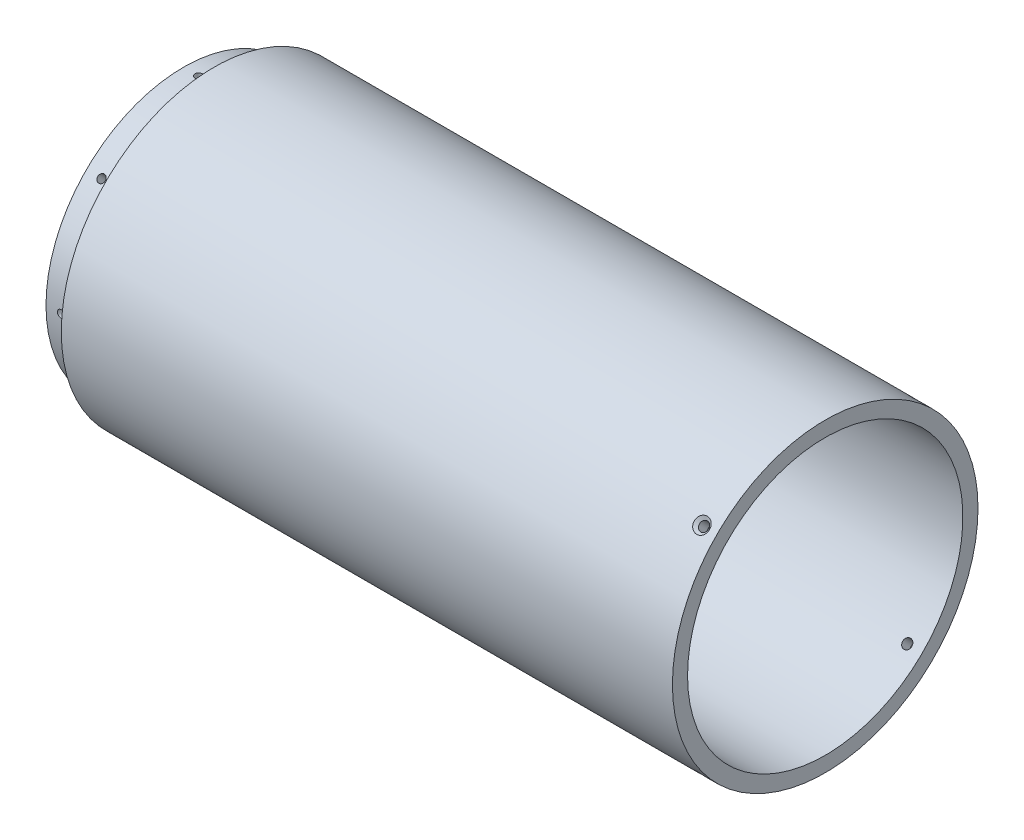
from build123d import *

# Parameters (mm, degrees)
CUT_EXTRUDE23_REACH      = 486.442
CUT_EXTRUDE23_END_RADIUS = 90.1
SKETCH23_R               = 3
CIRPATTERN30_COUNT       = 4
CUT_EXTRUDE25_REACH      = 486.442
CUT_EXTRUDE25_END_RADIUS = 80
SKETCH25_R               = 2.5
CIRPATTERN31_COUNT       = 8


with BuildPart() as part:
    # Sketch1 → Revolve1 (revolve)
    with BuildSketch(Plane.XY, mode=Mode.PRIVATE) as revolve1_sk:
        Polygon((0, 90.1), (-390, 90.1), (-390, 80), (-420, 80), (-420, 90), (-400, 90), (-400, 100), (0, 100), align=None)
    revolve(revolve1_sk.sketch.rotate(Axis((-171.770602606, 0, 0), (1, 0, 0)), 90), axis=Axis((-171.770602606, 0, 0), (1, 0, 0)))

    # Cut-Extrude23: up to this cylinder (the profile starts outside it)
    cut_extrude23_end = Plane(origin=(-10, 0, 0), z_dir=(-1, 0, 0)) * Cylinder(CUT_EXTRUDE23_END_RADIUS, 1154.084, mode=Mode.PRIVATE)
    # Sketch23 → Cut-Extrude23 (cut, up to the surface)
    with BuildSketch(Plane(origin=(0, -70.710678119, 70.710678119), x_dir=(1, 0, 0), z_dir=(0, -0.7071067811865478, 0.7071067811865474)), mode=Mode.PRIVATE) as cut_extrude23_sk1:
        with Locations(Location((-10, 0, 0), (0, 0, 270))):
            Circle(SKETCH23_R)
    cut_extrude23_tool1 = extrude(cut_extrude23_sk1.sketch, amount=-CUT_EXTRUDE23_REACH, mode=Mode.PRIVATE) - cut_extrude23_end
    cut_extrude23 = cut_extrude23_tool1.solids().sort_by_distance((-10, -70.710678, 70.710678))[0]
    add(cut_extrude23, mode=Mode.SUBTRACT)

    # Cut-Extrude24 cone 1 section (through the dimple's axis) → Cut-Extrude24 (revolve, cut)
    with BuildSketch(Plane(origin=(-10, -70.710678119, 70.710678119), x_dir=(0, -0.707106781, -0.707106781), z_dir=(1, 0, 0))):
        Polygon((0, 0), (5, 0), (0, 5), align=None)
    cut_extrude24 = revolve(axis=Axis((-10, -70.710678119, 70.710678119), (0, 0.707106781, -0.707106781)), mode=Mode.SUBTRACT)

    # CirPattern30: Cut-Extrude23, Cut-Extrude24 ×4 about axis
    cirpattern30_axis = Axis((-171.770602606, 0, 0), (1, 0, 0))
    add([cut_extrude23.rotate(cirpattern30_axis, i * 360 / CIRPATTERN30_COUNT) for i in range(1, CIRPATTERN30_COUNT)], mode=Mode.SUBTRACT)
    add([cut_extrude24.rotate(cirpattern30_axis, i * 360 / CIRPATTERN30_COUNT) for i in range(1, CIRPATTERN30_COUNT)], mode=Mode.SUBTRACT)

    # Cut-Extrude25: up to this cylinder (the profile starts outside it)
    cut_extrude25_end = Plane(origin=(-410, 0, 0), z_dir=(-1, 0, 0)) * Cylinder(CUT_EXTRUDE25_END_RADIUS, 1133.884, mode=Mode.PRIVATE)
    # Sketch25 → Cut-Extrude25 (cut, up to the surface)
    with BuildSketch(Plane(origin=(0, -70.710678119, 70.710678119), x_dir=(1, 0, 0), z_dir=(0, -0.7071067811865478, 0.7071067811865474)), mode=Mode.PRIVATE) as cut_extrude25_sk1:
        with Locations(Location((-410, 0, 0), (0, 0, 270))):
            Circle(SKETCH25_R)
    cut_extrude25_tool1 = extrude(cut_extrude25_sk1.sketch, amount=-CUT_EXTRUDE25_REACH, mode=Mode.PRIVATE) - cut_extrude25_end
    cut_extrude25 = cut_extrude25_tool1.solids().sort_by_distance((-410, -70.710678, 70.710678))[0]
    add(cut_extrude25, mode=Mode.SUBTRACT)

    # CirPattern31: Cut-Extrude25 ×8 about axis
    cirpattern31_axis = Axis((-171.770602606, 0, 0), (1, 0, 0))
    for i in range(1, CIRPATTERN31_COUNT):
        add(cut_extrude25.rotate(cirpattern31_axis, i * 360 / CIRPATTERN31_COUNT), mode=Mode.SUBTRACT)


solid = part.part
